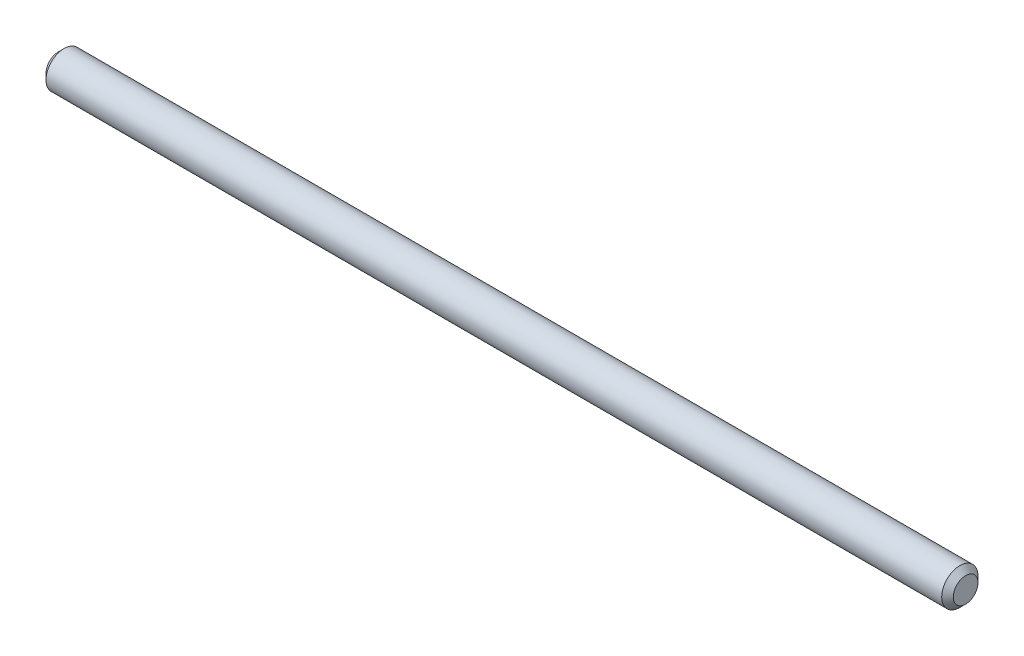
from build123d import *


with BuildPart() as part:
    # Esquisse1 → Révolution1 (revolve)
    with BuildSketch(Plane(origin=(0, 0, 0), x_dir=(-1, 0, 0), z_dir=(0, 0, -1)), mode=Mode.PRIVATE) as r_volution1_sk:
        Polygon((-200, 2.727207794), (-200, 0), (0, 0), (0, 2.727207794), (-1.272792206, 4), (-198.727207794, 4), align=None)
    revolve(r_volution1_sk.sketch.rotate(Axis((200, 0, 0), (-1, 0, 0)), 270), axis=Axis((200, 0, 0), (-1, 0, 0)))


solid = part.part
